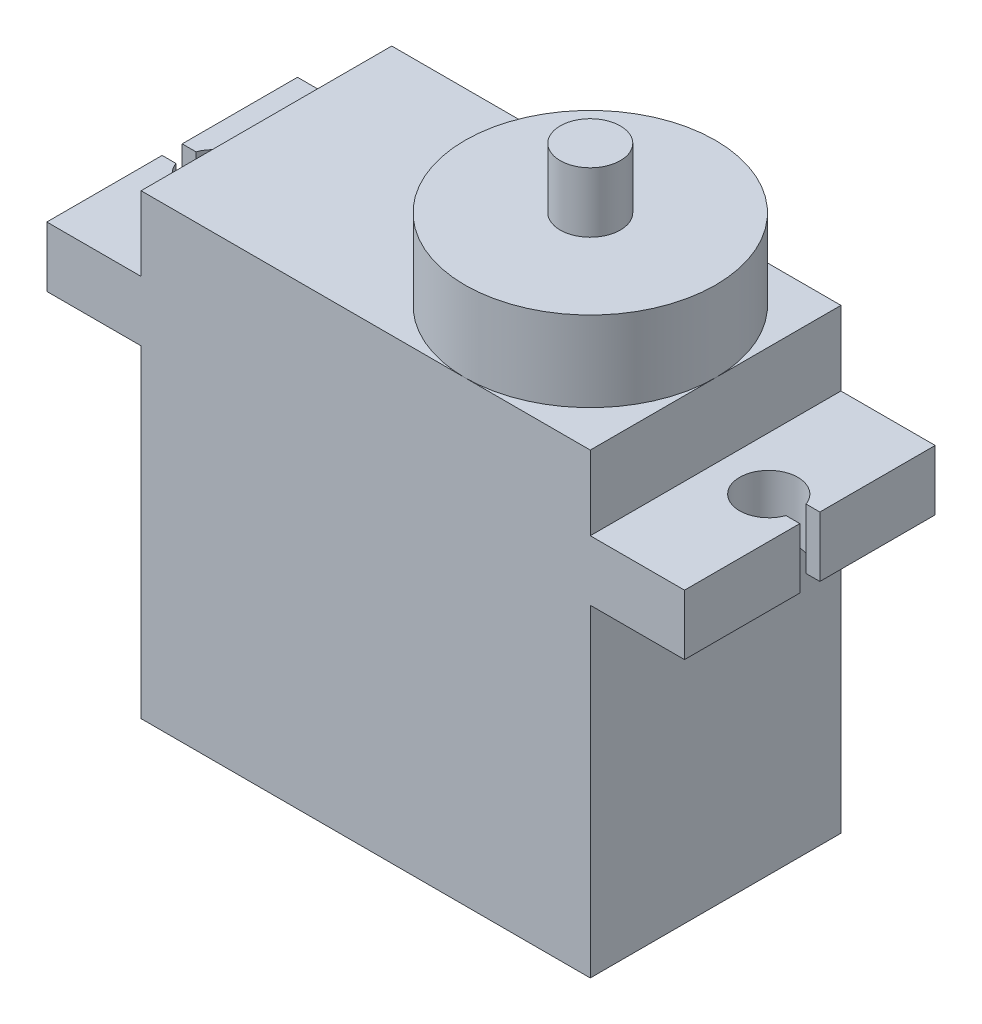
from build123d import *

# Parameters (mm, degrees)
EXTRUDE_1_DEPTH     = 12.5
CUT_EXTRUDE_2_REACH = 29.819
SKETCH_6_R          = 6.25
EXTRUDE_2_DEPTH     = 4
SKETCH_7_R          = 1.5
EXTRUDE_3_DEPTH     = 3


with BuildPart() as part:
    # 草图1 → 凸台-拉伸1 (new body)
    with BuildSketch(Plane.XY):
        Polygon((-11.2, 11.4), (11.2, 11.4), (11.2, 7.7), (15.9, 7.7), (15.9, 4.7), (11.2, 4.7), (11.2, -11.4), (-11.2, -11.4), (-11.2, 4.7), (-15.9, 4.7), (-15.9, 7.7), (-11.2, 7.7), align=None)
    extrude(amount=EXTRUDE_1_DEPTH)

    # 草图5 → 切除-拉伸2 (cut, up to next)
    with BuildSketch(Plane(origin=(0, 7.7, 0), x_dir=(1, 0, 0), z_dir=(0, 1, 0)), mode=Mode.PRIVATE) as cut_extrude_2_sk1:
        with BuildLine():
            Line((-15.211065759, -6.75), (-15.9, -6.75))
            Line((-15.9, -6.75), (-15.9, -5.75))
            Line((-15.9, -5.75), (-15.211065759, -5.75))
            ThreePointArc((-15.211065759, -5.75), (-12.4, -6.25), (-15.211065759, -6.75))
        make_face()
    cut_extrude_2_tool1 = extrude(cut_extrude_2_sk1.sketch, amount=-CUT_EXTRUDE_2_REACH, mode=Mode.PRIVATE) & part.part
    cut_extrude_2 = cut_extrude_2_tool1.solids().sort_by_distance((-14.000898, 7.7, 6.25))[0]
    add(cut_extrude_2, mode=Mode.SUBTRACT)

    # 镜向2: 切除-拉伸2 across plane
    add(cut_extrude_2.mirror(Plane(origin=(0, 0, 0), x_dir=(0, 0, 1), z_dir=(1, 0, 0))), mode=Mode.SUBTRACT)

    # 草图6 → 凸台-拉伸2 (add)
    with BuildSketch(Plane(origin=(0, 11.4, 0), x_dir=(1, 0, 0), z_dir=(0, 1, 0))):
        with Locations((4.95, -6.25)):
            Circle(SKETCH_6_R)
    extrude(amount=EXTRUDE_2_DEPTH)

    # 草图7 → 凸台-拉伸3 (add)
    with BuildSketch(Plane(origin=(0, 15.4, 0), x_dir=(1, 0, 0), z_dir=(0, 1, 0))):
        with Locations(Location((4.95, -6.25, 0), (0, 0, 180))):
            Circle(SKETCH_7_R)
    extrude(amount=EXTRUDE_3_DEPTH)


solid = part.part
